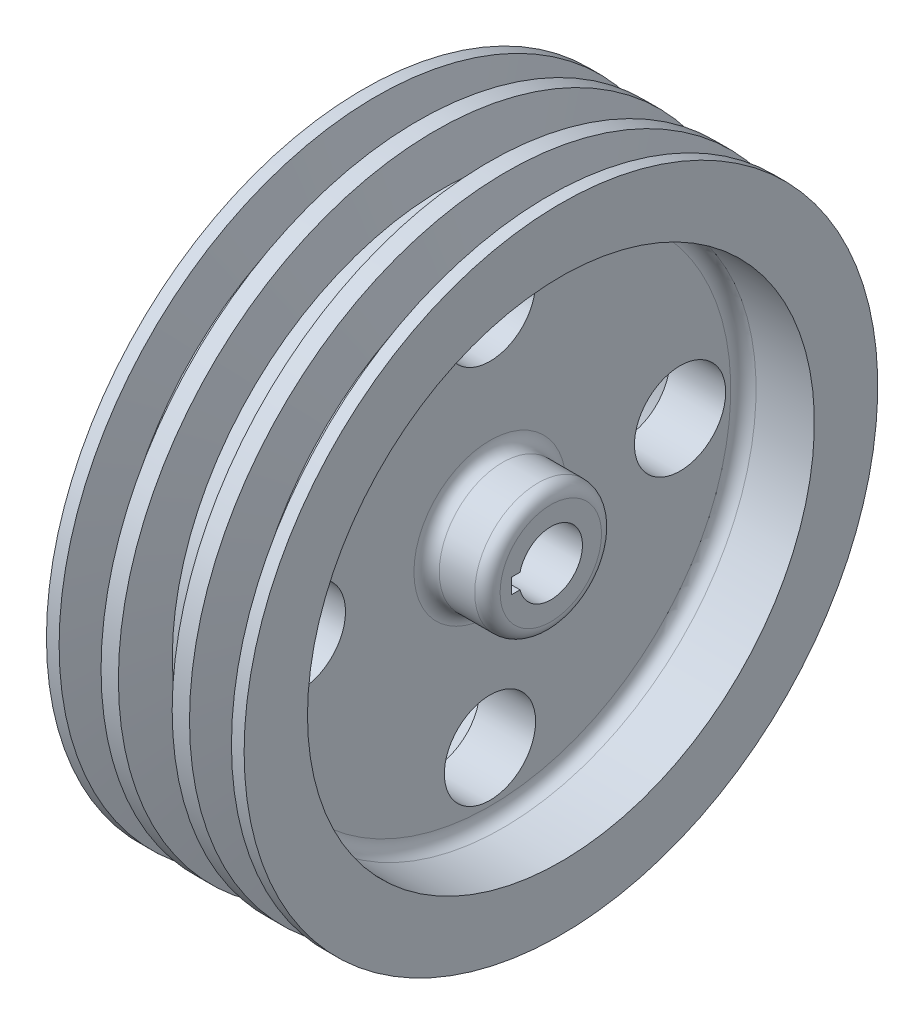
from build123d import *

# Parameters (mm, degrees)
CUT_EXTRUDE1_DEPTH      = 184.711730709
CUT_EXTRUDE1_DEPTH_BACK = 184.711730709
SKETCH2_R               = 18


with BuildPart() as part:
    # Sketch1 → Revolve2 (revolve)
    with BuildSketch(Plane.XY, mode=Mode.PRIVATE) as revolve2_sk:
        with BuildLine():
            Line((-10.611364858, 125), (-17.448535783, 125))
            Line((-17.448535783, 125), (-20.724267892, 107))
            Line((-20.724267892, 107), (-30.724267892, 107))
            Line((-30.724267892, 107), (-34, 125))
            Line((-34, 125), (-39, 125))
            Line((-39, 125), (-39, 100))
            Line((-39, 100), (-16, 100))
            ThreePointArc((-16, 100), (-12.464466094, 98.535533906), (-11, 95))
            Line((-11, 95), (-11, 30))
            ThreePointArc((-11, 30), (-12.464466094, 26.464466094), (-16, 25))
            Line((-16, 25), (-30, 25))
            ThreePointArc((-30, 25), (-33.535533906, 23.535533906), (-35, 20))
            Line((-35, 20), (-35, 12.5))
            Line((-35, 12.5), (0, 12.5))
            Line((0, 12.5), (35, 12.5))
            Line((35, 12.5), (35, 20))
            ThreePointArc((35, 20), (33.535533906, 23.535533906), (30, 25))
            Line((30, 25), (16, 25))
            ThreePointArc((16, 25), (12.464466094, 26.464466094), (11, 30))
            Line((11, 30), (11, 95))
            ThreePointArc((11, 95), (12.464466094, 98.535533906), (16, 100))
            Line((16, 100), (39, 100))
            Line((39, 100), (39, 125))
            Line((39, 125), (34, 125))
            Line((34, 125), (30.724267892, 107))
            Line((30.724267892, 107), (20.724267892, 107))
            Line((20.724267892, 107), (17.448535783, 125))
            Line((17.448535783, 125), (10.611364858, 125))
            Line((10.611364858, 125), (7.33563275, 107))
            Line((7.33563275, 107), (-7.33563275, 107))
            Line((-7.33563275, 107), (-10.611364858, 125))
        make_face()
    revolve(revolve2_sk.sketch.rotate(Axis((-121.58529461, 0, 0), (1, 0, 0)), 90), axis=Axis((-121.58529461, 0, 0), (1, 0, 0)))

    # Sketch2 → Cut-Extrude1 (cut, two sides: drawn at the far end of the back side and taken through both)
    with BuildSketch(Plane.ZY.offset(11).offset(-CUT_EXTRUDE1_DEPTH_BACK)):
        with Locations(Location((0, 75, 0), (0, 0, 180))):
            Circle(SKETCH2_R)
        with Locations(Location((75, 0, 0), (0, 0, 180))):
            Circle(SKETCH2_R)
        with Locations(Location((0, -75, 0), (0, 0, 180))):
            Circle(SKETCH2_R)
        with Locations(Location((-75, 0, 0), (0, 0, 180))):
            Circle(SKETCH2_R)
        with BuildLine():
            Line((15.5, -3), (15.5, 3))
            Line((15.5, 3), (12.1346611, 3))
            ThreePointArc((12.1346611, 3), (-12.5, 0), (12.1346611, -3))
            Line((12.1346611, -3), (15.5, -3))
        make_face()
    extrude(amount=CUT_EXTRUDE1_DEPTH + CUT_EXTRUDE1_DEPTH_BACK, mode=Mode.SUBTRACT)


solid = part.part
